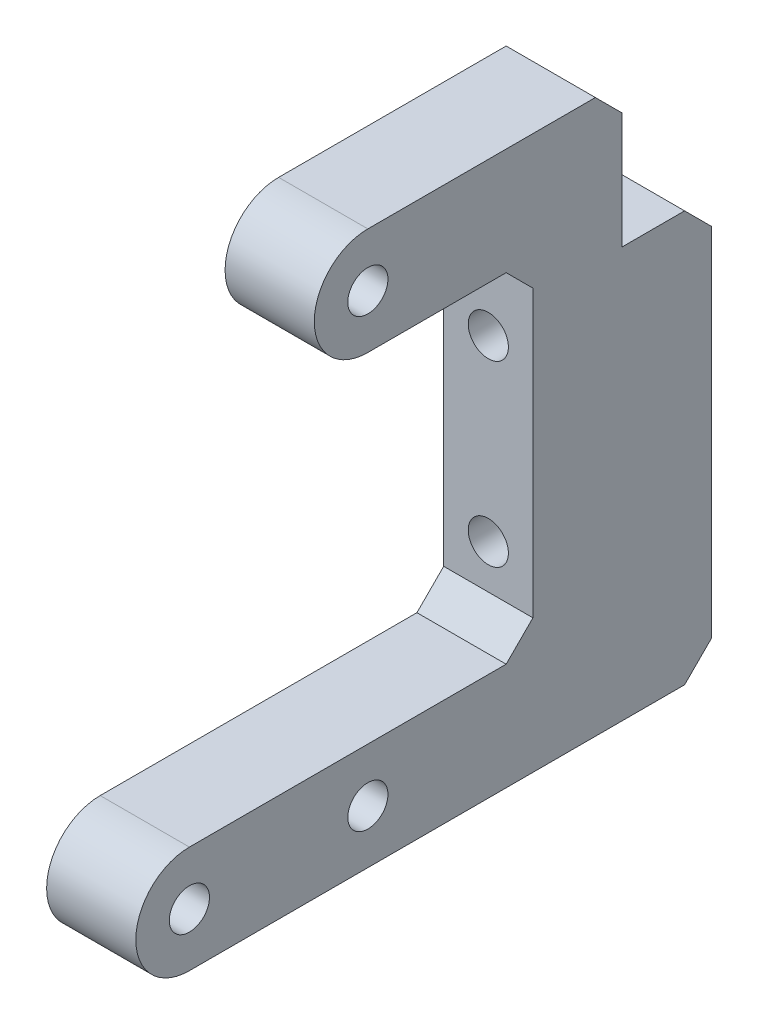
from build123d import *

# Parameters (mm, degrees)
SKETCH1_R           = 2.25
BOSS_EXTRUDE1_DEPTH = 5
SKETCH2_R           = 2.25
CUT_EXTRUDE1_DEPTH  = 72.702510416
SKETCH3_W           = 10
SKETCH3_H           = 16
CUT_EXTRUDE2_DEPTH  = 69.689518851
CHAMFER1_SIZE       = 3


with BuildPart() as part:
    # Sketch1 → Boss-Extrude1 (new, symmetric)
    with BuildSketch(Plane(origin=(0, 0, 0), x_dir=(0, 0, -1), z_dir=(1, 0, 0))):
        with BuildLine():
            Line((-20, -56), (38.5, -56))
            Line((38.5, -56), (38.5, 6))
            Line((38.5, 6), (0, 6))
            ThreePointArc((0, 6), (-6, 0), (0, -6))
            Line((0, -6), (18.5, -6))
            Line((18.5, -6), (18.5, -44))
            Line((18.5, -44), (-20, -44))
            ThreePointArc((-20, -44), (-26, -50), (-20, -56))
        make_face()
        Circle(SKETCH1_R, mode=Mode.SUBTRACT)
        with Locations((0, -50)):
            Circle(SKETCH1_R, mode=Mode.SUBTRACT)
        with Locations((-20, -50)):
            Circle(SKETCH1_R, mode=Mode.SUBTRACT)
    extrude(amount=BOSS_EXTRUDE1_DEPTH, both=True)

    # Sketch2 → Cut-Extrude1 (cut, through all)
    with BuildSketch(Plane.XY.offset(-18.5)):
        with Locations((0, -16.1)):
            Circle(SKETCH2_R)
        with Locations((0, -36.1)):
            Circle(SKETCH2_R)
    extrude(amount=-CUT_EXTRUDE1_DEPTH, mode=Mode.SUBTRACT)

    # Sketch3 → Cut-Extrude2 (cut, through all)
    with BuildSketch(Plane(origin=(5, 0, 0), x_dir=(0, 0, -1), z_dir=(1, 0, 0))):
        with Locations((33.5, -2)):
            Rectangle(SKETCH3_W, SKETCH3_H)
    extrude(amount=-CUT_EXTRUDE2_DEPTH, mode=Mode.SUBTRACT)

    # Chamfer1
    chamfer1_edges = [part.edges().sort_by_distance(p)[0] for p in [
        (0, -44, -18.5),
        (0, -6, -18.5),
        (0, -56, -38.5),
        (0, -10, -38.5),
        (0, 6, -28.5),
    ]]
    chamfer(chamfer1_edges, length=CHAMFER1_SIZE)


solid = part.part
